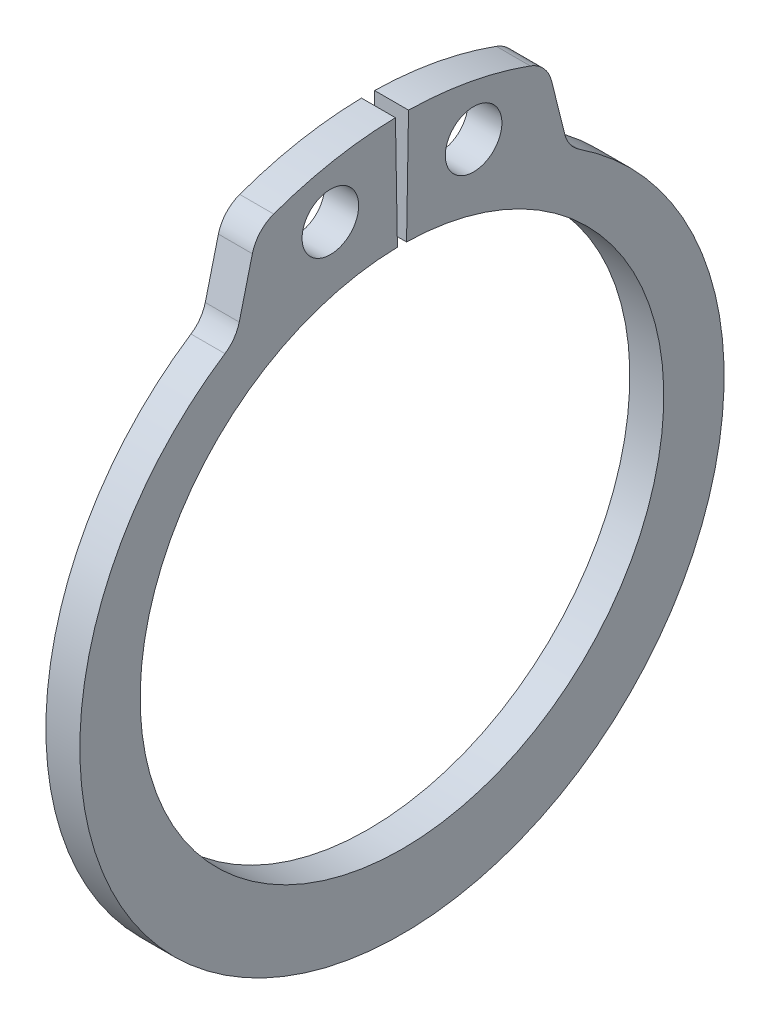
from build123d import *

# Parameters (mm, degrees)
SKETCH1_R      = 1
EXTRUDE1_DEPTH = 0.6
FILLET1_R      = 1.2


with BuildPart() as part:
    # Sketch1 → Extrude1 (new, symmetric)
    with BuildSketch(Plane(origin=(0, 0, 0), x_dir=(0, 0, -1), z_dir=(1, 0, 0))):
        with BuildLine():
            Line((-0.16143476, 9.24859118), (-0.231244385, 13.247981961))
            ThreePointArc((-0.231244385, 13.247981961), (-2.73314864, 12.965045257), (-5.136358645, 12.213939572))
            Line((-5.136358645, 12.213939572), (-5.866544122, 9.285325583))
            ThreePointArc((-5.866544122, 9.285325583), (0, -11.85), (5.866544122, 9.285325583))
            Line((5.866544122, 9.285325583), (5.136358645, 12.213939572))
            ThreePointArc((5.136358645, 12.213939572), (2.73314864, 12.965045257), (0.231244385, 13.247981961))
            Line((0.231244385, 13.247981961), (0.16143476, 9.24859118))
            ThreePointArc((0.16143476, 9.24859118), (0, -9.25), (-0.16143476, 9.24859118))
        make_face()
        with Locations((-2.53014565, 11.207549834)):
            Circle(SKETCH1_R, mode=Mode.SUBTRACT)
        with Locations((2.53014565, 11.207549834)):
            Circle(SKETCH1_R, mode=Mode.SUBTRACT)
    extrude(amount=EXTRUDE1_DEPTH, both=True)

    # Fillet1
    fillet1_edges = [part.edges().sort_by_distance(p)[0] for p in [
        (0, 12.213939572, -5.136358645),
        (0, 9.285325583, -5.866544122),
        (0, 9.285325583, 5.866544122),
        (0, 12.213939572, 5.136358645),
    ]]
    fillet(fillet1_edges, radius=FILLET1_R)


solid = part.part
